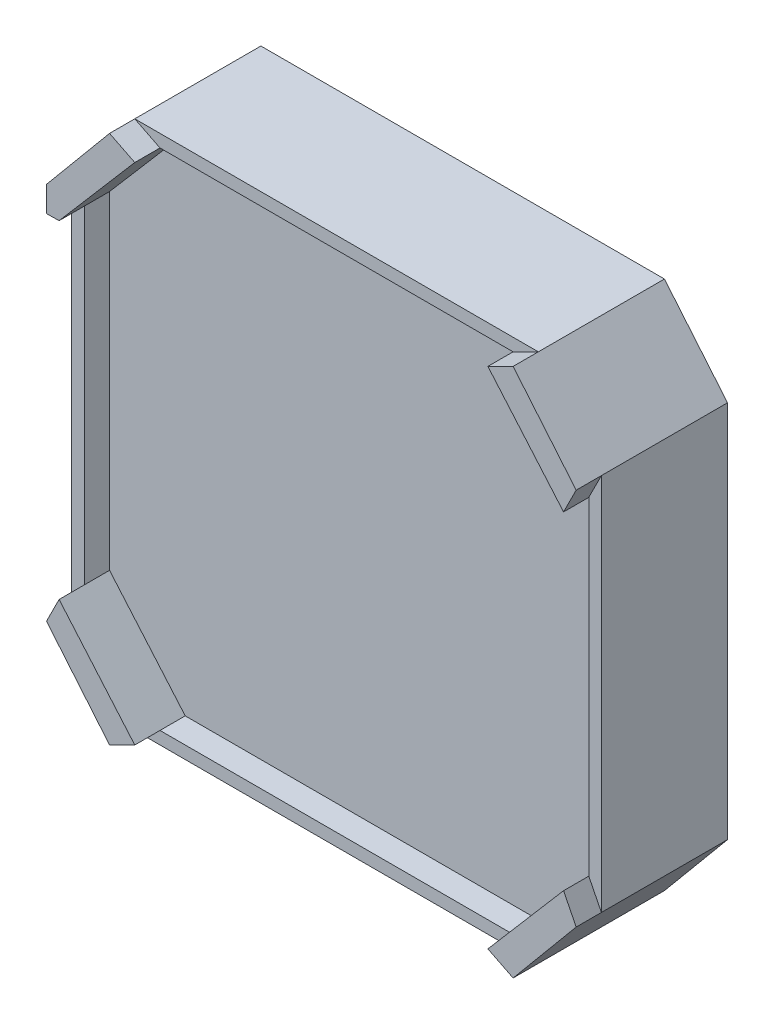
from build123d import *

# Parameters (mm, degrees)
SALIENTE_EXTRUIR1_DEPTH = 10
CORTAR_EXTRUIR1_DEPTH   = 2
SALIENTE_EXTRUIR2_DEPTH = 2
CROQUIS5_R              = 1.4
CROQUIS5_R_2            = 2.5
CORTAR_EXTRUIR2_DEPTH   = 5
CROQUIS6_R              = 15
CORTAR_EXTRUIR3_DEPTH   = 1
CROQUIS7_R              = 11
CROQUIS7_R_2            = 4
SALIENTE_EXTRUIR3_DEPTH = 3


with BuildPart() as part:
    # Croquis2 → Saliente-Extruir1 (new body)
    with BuildSketch(Plane.XY):
        Polygon((-16, 21), (16, 21), (21, 15), (21, -15), (16, -21), (-16, -21), (-21, -15), (-21, 15), align=None)
    extrude(amount=SALIENTE_EXTRUIR1_DEPTH)

    # Croquis3 → Cortar-Extruir1 (cut)
    with BuildSketch(Plane.XY.offset(10)):
        Polygon((-14, 20), (14, 20), (20, 13.004934109), (20, -13.004934109), (14, -20), (-14, -20), (-20, -13.004934109), (-20, 13.004934109), align=None)
    extrude(amount=-CORTAR_EXTRUIR1_DEPTH, mode=Mode.SUBTRACT)

    # Croquis4 → Saliente-Extruir2 (add)
    with BuildSketch(Plane.XY.offset(10)):
        Polygon((-16, -21), (-14, -20), (-20, -13.004934109), (-21, -15), align=None)
        Polygon((-20, 13.004934109), (-14, 20), (-16, 21), (-21, 15), (-21, 12.992008233), align=None)
        Polygon((16, 21), (21, 15), (20, 13.004934109), (14, 20), align=None)
        Polygon((16, -21), (21, -15), (20, -13.004934109), (14, -20), align=None)
    extrude(amount=SALIENTE_EXTRUIR2_DEPTH)

    # Croquis5 → Cortar-Extruir2 (cut)
    with BuildSketch(Plane(origin=(0, 0, 0), x_dir=(-1, 0, 0), z_dir=(0, 0, -1))):
        with Locations((15.5, 15.5)):
            Circle(CROQUIS5_R)
        with Locations(Location((-15.5, 15.5, 0), (0, 0, 180))):
            Circle(CROQUIS5_R)
        with Locations(Location((15.5, -15.5, 0), (0, 0, 180))):
            Circle(CROQUIS5_R)
        with Locations((-15.5, -15.5)):
            Circle(CROQUIS5_R)
        Circle(CROQUIS5_R_2)
    extrude(amount=-CORTAR_EXTRUIR2_DEPTH, mode=Mode.SUBTRACT)

    # Croquis6 → Cortar-Extruir3 (cut)
    with BuildSketch(Plane(origin=(0, 0, 0), x_dir=(-1, 0, 0), z_dir=(0, 0, -1))):
        Circle(CROQUIS6_R)
    extrude(amount=-CORTAR_EXTRUIR3_DEPTH, mode=Mode.SUBTRACT)

    # Croquis7 → Saliente-Extruir3 (add)
    with BuildSketch(Plane(origin=(0, 0, 1), x_dir=(-1, 0, 0), z_dir=(0, 0, -1))):
        Circle(CROQUIS7_R)
        Circle(CROQUIS7_R_2, mode=Mode.SUBTRACT)
    extrude(amount=SALIENTE_EXTRUIR3_DEPTH)


solid = part.part
